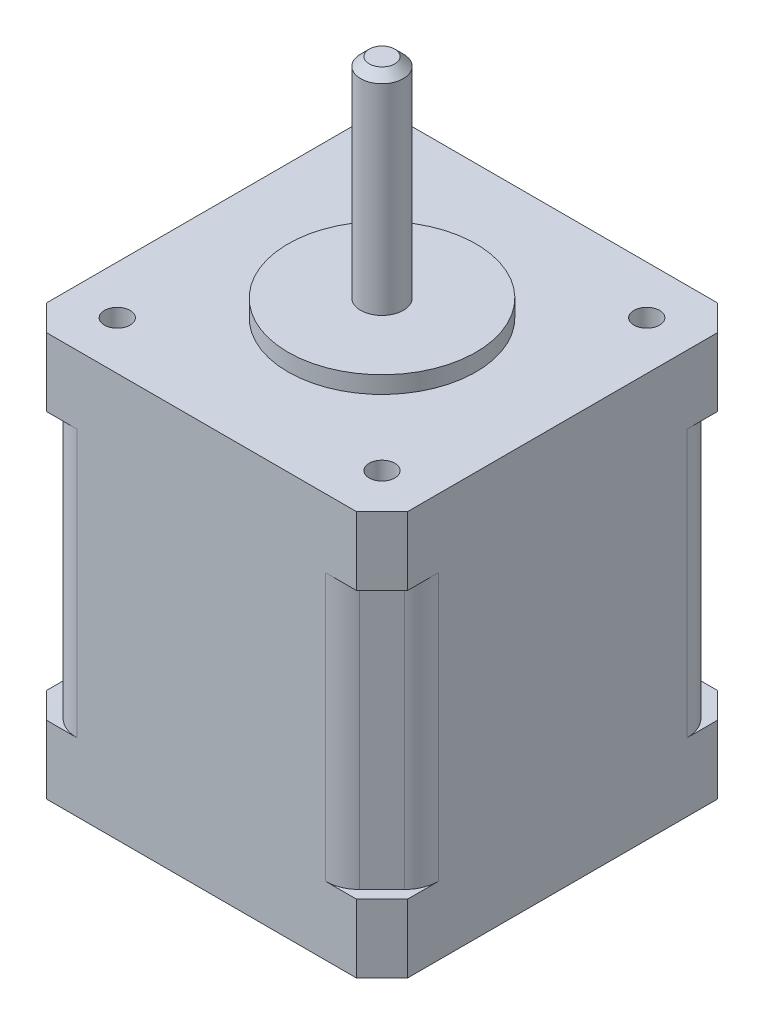
from build123d import *

# Parameters (mm, degrees)
ESQUISSE1_W             = 42.3
ESQUISSE1_H             = 42.3
ESQUISSE1_R             = 2.5
ESQUISSE1_R_2           = 1.5
BOSS_EXTRU_1_DEPTH      = 47.3
ESQUISSE2_R             = 11
BOSS_EXTRU_2_DEPTH      = 2
ESQUISSE3_R             = 2.5
BOSS_EXTRU_3_DEPTH      = 24.5
CHANFREIN1_SIZE         = 1
ENL_V_START             = -8
ESQUISSE4_OUTSIDE_W     = 63.3
ESQUISSE4_OUTSIDE_H     = 63.3
ENL_V_MAT_EXTRU_1_DEPTH = 31.3
CHANFREIN2_SIZE         = 3
ESQUISSE5_R             = 3
ENL_V_MAT_EXTRU_2_DEPTH = 2
ESQUISSE6_W             = 8
ESQUISSE6_H             = 4
BOSS_EXTRU_4_DEPTH      = 2
BOSS_EXTRU_6_DEPTH      = 2


with BuildPart() as part:
    # Esquisse1 → Boss.-Extru.1 (new body)
    with BuildSketch(Plane(origin=(0, 0, 0), x_dir=(1, 0, 0), z_dir=(0, 1, 0))):
        with Locations((5.302542373, -6.446610169)):
            Rectangle(ESQUISSE1_W, ESQUISSE1_H)
        with Locations(Location((5.302542373, -6.446610169, 0), (0, 0, 270))):
            Circle(ESQUISSE1_R, mode=Mode.SUBTRACT)
        with Locations(Location((-10.197457627, 9.053389831, 0), (0, 0, 270))):
            Circle(ESQUISSE1_R_2, mode=Mode.SUBTRACT)
        with Locations(Location((20.802542373, 9.053389831, 0), (0, 0, 270))):
            Circle(ESQUISSE1_R_2, mode=Mode.SUBTRACT)
        with Locations(Location((20.802542373, -21.946610169, 0), (0, 0, 270))):
            Circle(ESQUISSE1_R_2, mode=Mode.SUBTRACT)
        with Locations(Location((-10.197457627, -21.946610169, 0), (0, 0, 270))):
            Circle(ESQUISSE1_R_2, mode=Mode.SUBTRACT)
    extrude(amount=BOSS_EXTRU_1_DEPTH)

    # Esquisse2 → Boss.-Extru.2 (add)
    with BuildSketch(Plane(origin=(0, 47.3, 0), x_dir=(1, 0, 0), z_dir=(0, 1, 0))):
        with Locations(Location((5.302542373, -6.446610169, 0), (0, 0, 270))):
            Circle(ESQUISSE2_R)
    extrude(amount=BOSS_EXTRU_2_DEPTH)

    # Esquisse3 → Boss.-Extru.3 (add)
    with BuildSketch(Plane(origin=(0, 49.3, 0), x_dir=(1, 0, 0), z_dir=(0, 1, 0))):
        with Locations(Location((5.302542373, -6.446610169, 0), (0, 0, 270))):
            Circle(ESQUISSE3_R)
    extrude(amount=BOSS_EXTRU_3_DEPTH)

    # Chanfrein1
    chanfrein1_edges = [part.edges().sort_by_distance(p)[0] for p in [
        (5.302542373, 73.8, 3.946610169),
    ]]
    chamfer(chanfrein1_edges, length=CHANFREIN1_SIZE)

    # Esquisse4 outside → Enlèv. mat.-Extru.1 (cut)
    with BuildSketch(Plane(origin=(0, 47.3, 0), x_dir=(1, 0, 0), z_dir=(0, 1, 0)).offset(ENL_V_START)):
        with Locations((5.303, -6.447)):
            Rectangle(ESQUISSE4_OUTSIDE_W, ESQUISSE4_OUTSIDE_H)
        with BuildLine():
            Line((-14.675884752, -23.818435576), (-12.069283034, -26.425037294))
            ThreePointArc((-12.069283034, -26.425037294), (-10.771589639, -27.2921283), (-9.240855909, -27.596610169))
            Line((-9.240855909, -27.596610169), (19.845940655, -27.596610169))
            ThreePointArc((19.845940655, -27.596610169), (21.376674385, -27.2921283), (22.67436778, -26.425037294))
            Line((22.67436778, -26.425037294), (25.280969498, -23.818435576))
            ThreePointArc((25.280969498, -23.818435576), (26.148060503, -22.520742181), (26.452542373, -20.990008452))
            Line((26.452542373, -20.990008452), (26.452542373, 8.096788113))
            ThreePointArc((26.452542373, 8.096788113), (26.148060503, 9.627521842), (25.280969498, 10.925215237))
            Line((25.280969498, 10.925215237), (22.67436778, 13.531816955))
            ThreePointArc((22.67436778, 13.531816955), (21.376674385, 14.398907961), (19.845940655, 14.703389831))
            Line((19.845940655, 14.703389831), (-9.240855909, 14.703389831))
            ThreePointArc((-9.240855909, 14.703389831), (-10.771589639, 14.398907961), (-12.069283034, 13.531816955))
            Line((-12.069283034, 13.531816955), (-14.675884752, 10.925215237))
            ThreePointArc((-14.675884752, 10.925215237), (-15.542975757, 9.627521842), (-15.847457627, 8.096788113))
            Line((-15.847457627, 8.096788113), (-15.847457627, -20.990008452))
            ThreePointArc((-15.847457627, -20.990008452), (-15.542975757, -22.520742181), (-14.675884752, -23.818435576))
        make_face(mode=Mode.SUBTRACT)
    extrude(amount=-ENL_V_MAT_EXTRU_1_DEPTH, mode=Mode.SUBTRACT)

    # Chanfrein2
    chanfrein2_edges = [part.edges().sort_by_distance(p)[0] for p in [
        (-15.847457627, 4, -14.703389831),
        (26.452542373, 4, -14.703389831),
        (26.452542373, 4, 27.596610169),
        (-15.847457627, 4, 27.596610169),
        (-15.847457627, 43.3, -14.703389831),
        (26.452542373, 43.3, -14.703389831),
        (26.452542373, 43.3, 27.596610169),
        (-15.847457627, 43.3, 27.596610169),
    ]]
    chamfer(chanfrein2_edges, length=CHANFREIN2_SIZE)

    # Esquisse5 → Enlèv. mat.-Extru.2 (cut)
    with BuildSketch(Plane.XZ):
        with Locations(Location((-10.197457627, -9.053389831, 0), (0, 0, 270))):
            Circle(ESQUISSE5_R)
        with Locations(Location((-10.197457627, 21.946610169, 0), (0, 0, 270))):
            Circle(ESQUISSE5_R)
        with Locations(Location((20.802542373, 21.946610169, 0), (0, 0, 270))):
            Circle(ESQUISSE5_R)
        with Locations(Location((20.802542373, -9.053389831, 0), (0, 0, 270))):
            Circle(ESQUISSE5_R)
    extrude(amount=-ENL_V_MAT_EXTRU_2_DEPTH, mode=Mode.SUBTRACT)

    # Esquisse6 → Boss.-Extru.4 (add)
    with BuildSketch(Plane(origin=(0, 0, -14.703389831), x_dir=(-1, 0, 0), z_dir=(0, 0, -1))):
        with Locations((-5.302542373, 2)):
            Rectangle(ESQUISSE6_W, ESQUISSE6_H)
    extrude(amount=BOSS_EXTRU_4_DEPTH)

    # Esquisse7 → Boss.-Extru.6 (add)
    with BuildSketch(Plane(origin=(0, 0, -16.703389831), x_dir=(-1, 0, 0), z_dir=(0, 0, -1))):
        with BuildLine():
            ThreePointArc((-7.052542373, 2), (-6.98795672, 2.353553391), (-6.802542373, 2.661437828))
            ThreePointArc((-6.802542373, 2.661437828), (-7.906095763, 2.935414347), (-8.552542373, 2))
            Line((-8.552542373, 2), (-7.052542373, 2))
        make_face()
        with BuildLine():
            ThreePointArc((-6.552542373, 2), (-6.617128026, 2.353553391), (-6.802542373, 2.661437828))
            ThreePointArc((-6.802542373, 2.661437828), (-6.98795672, 2.353553391), (-7.052542373, 2))
            Line((-7.052542373, 2), (-6.552542373, 2))
        make_face()
        with BuildLine():
            ThreePointArc((-7.052542373, 2), (-6.98795672, 1.646446609), (-6.802542373, 1.338562172))
            ThreePointArc((-6.802542373, 1.338562172), (-6.617128026, 1.646446609), (-6.552542373, 2))
            Line((-6.552542373, 2), (-7.052542373, 2))
        make_face()
        with BuildLine():
            ThreePointArc((-8.552542373, 2), (-7.906095763, 1.064585653), (-6.802542373, 1.338562172))
            ThreePointArc((-6.802542373, 1.338562172), (-6.98795672, 1.646446609), (-7.052542373, 2))
            Line((-7.052542373, 2), (-8.552542373, 2))
        make_face()
        with BuildLine():
            ThreePointArc((-5.552542373, 2), (-5.48795672, 2.353553391), (-5.302542373, 2.661437828))
            ThreePointArc((-5.302542373, 2.661437828), (-6.052542373, 3), (-6.802542373, 2.661437828))
            ThreePointArc((-6.802542373, 2.661437828), (-6.617128026, 2.353553391), (-6.552542373, 2))
            Line((-6.552542373, 2), (-5.552542373, 2))
        make_face()
        with BuildLine():
            ThreePointArc((-6.802542373, 1.338562172), (-6.052542373, 1), (-5.302542373, 1.338562172))
            ThreePointArc((-5.302542373, 1.338562172), (-5.48795672, 1.646446609), (-5.552542373, 2))
            Line((-5.552542373, 2), (-6.552542373, 2))
            ThreePointArc((-6.552542373, 2), (-6.617128026, 1.646446609), (-6.802542373, 1.338562172))
        make_face()
        with BuildLine():
            ThreePointArc((-3.802542373, 1.338562172), (-3.98795672, 1.646446609), (-4.052542373, 2))
            Line((-4.052542373, 2), (-5.052542373, 2))
            ThreePointArc((-5.052542373, 2), (-5.117128026, 1.646446609), (-5.302542373, 1.338562172))
            ThreePointArc((-5.302542373, 1.338562172), (-4.552542373, 1), (-3.802542373, 1.338562172))
        make_face()
        with BuildLine():
            Line((-5.052542373, 2), (-4.052542373, 2))
            ThreePointArc((-4.052542373, 2), (-3.98795672, 2.353553391), (-3.802542373, 2.661437828))
            ThreePointArc((-3.802542373, 2.661437828), (-4.552542373, 3), (-5.302542373, 2.661437828))
            ThreePointArc((-5.302542373, 2.661437828), (-5.117128026, 2.353553391), (-5.052542373, 2))
        make_face()
        with BuildLine():
            ThreePointArc((-3.802542373, 2.661437828), (-3.617128026, 2.353553391), (-3.552542373, 2))
            Line((-3.552542373, 2), (-2.052542373, 2))
            ThreePointArc((-2.052542373, 2), (-2.698988982, 2.935414347), (-3.802542373, 2.661437828))
        make_face()
        with BuildLine():
            ThreePointArc((-3.802542373, 1.338562172), (-3.617128026, 1.646446609), (-3.552542373, 2))
            Line((-3.552542373, 2), (-4.052542373, 2))
            ThreePointArc((-4.052542373, 2), (-3.98795672, 1.646446609), (-3.802542373, 1.338562172))
        make_face()
        with BuildLine():
            Line((-4.052542373, 2), (-3.552542373, 2))
            ThreePointArc((-3.552542373, 2), (-3.617128026, 2.353553391), (-3.802542373, 2.661437828))
            ThreePointArc((-3.802542373, 2.661437828), (-3.98795672, 2.353553391), (-4.052542373, 2))
        make_face()
        with BuildLine():
            Line((-2.052542373, 2), (-3.552542373, 2))
            ThreePointArc((-3.552542373, 2), (-3.617128026, 1.646446609), (-3.802542373, 1.338562172))
            ThreePointArc((-3.802542373, 1.338562172), (-2.698988982, 1.064585653), (-2.052542373, 2))
        make_face()
        with BuildLine():
            ThreePointArc((-5.302542373, 1.338562172), (-5.117128026, 1.646446609), (-5.052542373, 2))
            Line((-5.052542373, 2), (-5.552542373, 2))
            ThreePointArc((-5.552542373, 2), (-5.48795672, 1.646446609), (-5.302542373, 1.338562172))
        make_face()
        with BuildLine():
            Line((-5.552542373, 2), (-5.052542373, 2))
            ThreePointArc((-5.052542373, 2), (-5.117128026, 2.353553391), (-5.302542373, 2.661437828))
            ThreePointArc((-5.302542373, 2.661437828), (-5.48795672, 2.353553391), (-5.552542373, 2))
        make_face()
    extrude(amount=BOSS_EXTRU_6_DEPTH)


solid = part.part
